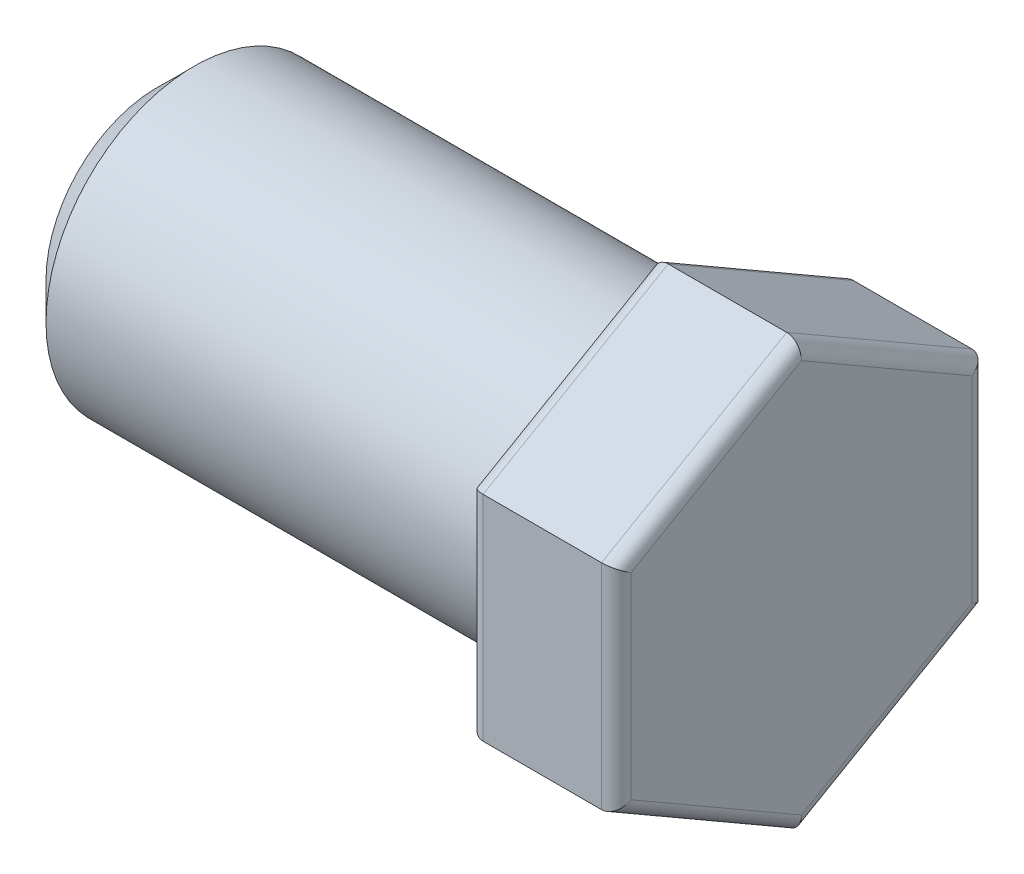
from build123d import *

# Parameters (mm, degrees)
BOSS_EXTRUDE1_DEPTH = 1
FILLET1_R           = 0.2
SKETCH2_R           = 2
BOSS_EXTRUDE2_DEPTH = 6.7
CHAMFER1_SIZE       = 0.5
FILLET2_R           = 0.2


with BuildPart() as part:
    # Sketch1 → Boss-Extrude1 (new, symmetric)
    with BuildSketch(Plane(origin=(0, 0, 0), x_dir=(0, 0, -1), z_dir=(1, 0, 0))):
        Polygon((2.5, 1.443375673), (0, 2.886751346), (-2.5, 1.443375673), (-2.5, -1.443375673), (0, -2.886751346), (2.5, -1.443375673), align=None)
    extrude(amount=BOSS_EXTRUDE1_DEPTH, both=True)

    # Fillet1
    fillet1_edges = [part.edges().sort_by_distance(p)[0] for p in [
        (1, 2.165063509, 1.25),
        (1, 0, 2.5),
        (1, -2.165063509, 1.25),
        (1, -2.165063509, -1.25),
        (1, 0, -2.5),
        (-1, -2.165063509, -1.25),
        (-1, -2.165063509, 1.25),
        (-1, 0, 2.5),
        (-1, 2.165063509, 1.25),
        (-1, 2.165063509, -1.25),
        (-1, 0, -2.5),
        (1, 2.165063509, -1.25),
    ]]
    fillet(fillet1_edges, radius=FILLET1_R)

    # Sketch2 → Boss-Extrude2 (add)
    with BuildSketch(Plane.ZY.offset(1)):
        with Locations(Location((0, 0, 0), (0, 0, 180))):
            Circle(SKETCH2_R)
    extrude(amount=BOSS_EXTRUDE2_DEPTH)

    # Chamfer1
    chamfer1_edges = [part.edges().sort_by_distance(p)[0] for p in [
        (-7.7, 0, 2),
    ]]
    chamfer(chamfer1_edges, length=CHAMFER1_SIZE)

    # Fillet2
    fillet2_edges = [part.edges().sort_by_distance(p)[0] for p in [
        (-1, 0, 2),
    ]]
    fillet(fillet2_edges, radius=FILLET2_R)


solid = part.part
